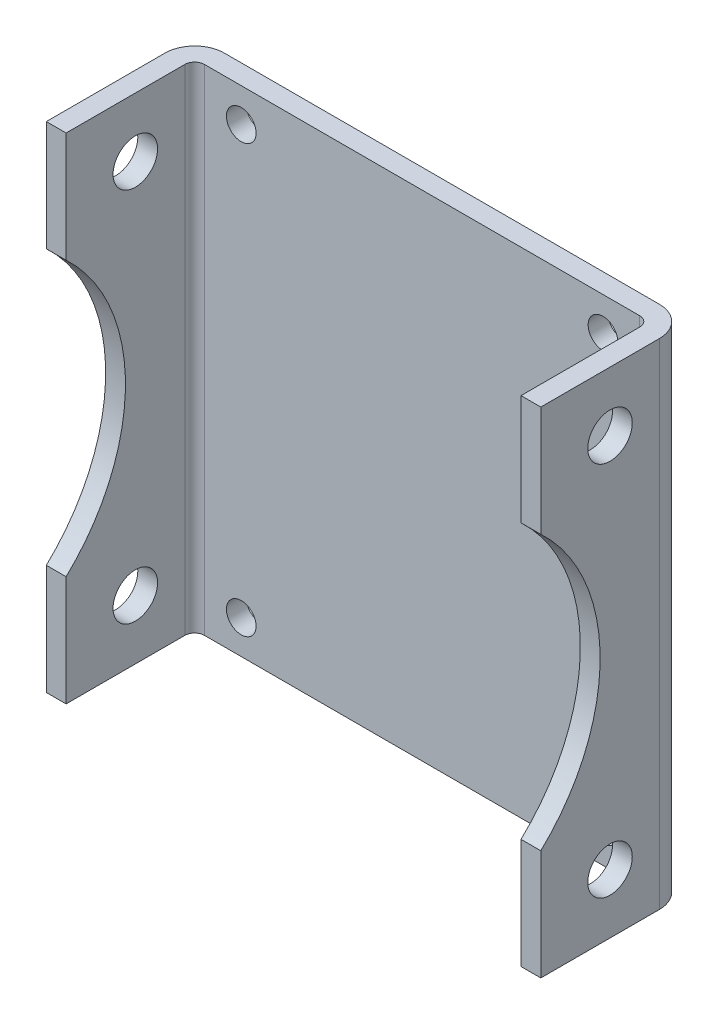
from build123d import *

# Parameters (mm, degrees)
BOSS_EXTRUDE1_DEPTH = 50
SKETCH2_R           = 19
SKETCH2_R_2         = 2.25
CUT_EXTRUDE1_DEPTH  = 73.284161474
SKETCH3_R           = 1.5
CUT_EXTRUDE2_DEPTH  = 10


with BuildPart() as part:
    # Sketch1 → Boss-Extrude1 (new body)
    with BuildSketch(Plane(origin=(0, 0, 0), x_dir=(1, 0, 0), z_dir=(0, 1, 0))):
        with BuildLine():
            Line((-2, 0), (-2, 12))
            ThreePointArc((-2, 12), (-1.121320344, 14.121320344), (1, 15))
            Line((1, 15), (45, 15))
            ThreePointArc((45, 15), (47.121320344, 14.121320344), (48, 12))
            Line((48, 12), (48, 0))
            Line((48, 0), (46, 0))
            Line((46, 0), (46, 12))
            ThreePointArc((46, 12), (45.707106781, 12.707106781), (45, 13))
            Line((45, 13), (1, 13))
            ThreePointArc((1, 13), (0.292893219, 12.707106781), (0, 12))
            Line((0, 12), (0, 0))
            Line((0, 0), (-2, 0))
        make_face()
    extrude(amount=BOSS_EXTRUDE1_DEPTH)

    # Sketch2 → Cut-Extrude1 (cut, through all)
    with BuildSketch(Plane(origin=(48, 0, 0), x_dir=(0, 0, -1), z_dir=(1, 0, 0))):
        with Locations((-13, 25)):
            Circle(SKETCH2_R)
        with Locations((7, 44)):
            Circle(SKETCH2_R_2)
        with Locations((7, 6)):
            Circle(SKETCH2_R_2)
    extrude(amount=-CUT_EXTRUDE1_DEPTH, mode=Mode.SUBTRACT)

    # Sketch3 → Cut-Extrude2 (cut)
    with BuildSketch(Plane(origin=(0, 0, -15), x_dir=(-1, 0, 0), z_dir=(0, 0, -1))):
        with Locations((-41.29, 46.59)):
            Circle(SKETCH3_R)
        with Locations((-4.71, 46.59)):
            Circle(SKETCH3_R)
        with Locations((-4.71, 3.41)):
            Circle(SKETCH3_R)
        with Locations((-41.29, 3.41)):
            Circle(SKETCH3_R)
    extrude(amount=-CUT_EXTRUDE2_DEPTH, mode=Mode.SUBTRACT)


solid = part.part
